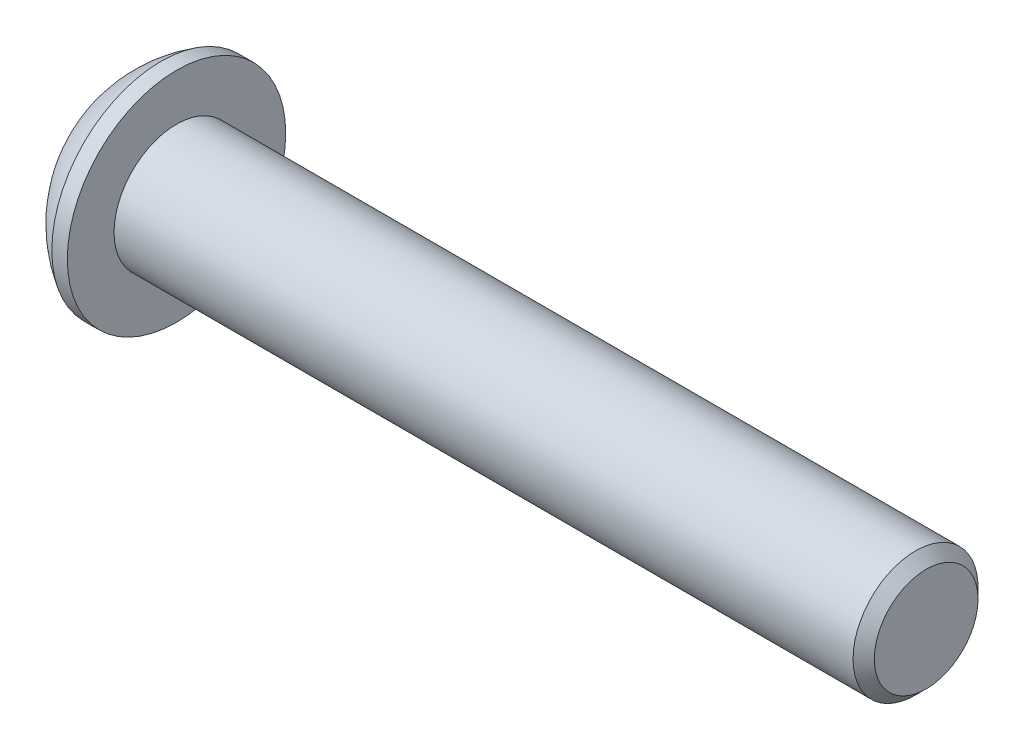
from build123d import *

# Parameters (mm, degrees)
HEX_2_DEPTH = 2.2098


with BuildPart() as part:
    # BodySke → BaseBody (revolve)
    with BuildSketch(Plane.XY, mode=Mode.PRIVATE) as basebody_sk:
        with BuildLine():
            Line((41.4528, 0), (41.4528, 2.63398))
            Line((41.4528, 2.63398), (40.91178, 3.175))
            Line((40.91178, 3.175), (3.3528, 3.175))
            Line((3.3528, 3.175), (3.3528, 5.5499))
            Line((3.3528, 5.5499), (2.5654, 5.5499))
            ThreePointArc((2.5654, 5.5499), (1.073764503, 4.355582759), (0, 2.77495))
            Line((0, 2.77495), (0, 0))
            Line((0, 0), (41.4528, 0))
        make_face()
    revolve(basebody_sk.sketch.rotate(Axis((0, 0, 0), (1, 0, 0)), 90), axis=Axis((0, 0, 0), (1, 0, 0)))

    # Sketch2 → PreBroach (revolve, cut)
    with BuildSketch(Plane.XY, mode=Mode.PRIVATE) as prebroach_sk:
        Polygon((0, 1.9812), (2.2098, 1.9812), (3.353646353, 0), (0, 0), align=None)
    revolve(prebroach_sk.sketch.rotate(Axis((0, 0, 0), (1, 0, 0)), 90), axis=Axis((0, 0, 0), (1, 0, 0)), mode=Mode.SUBTRACT)

    # Sketch3 → Hex 2 (cut)
    with BuildSketch(Plane(origin=(0, 0, 0), x_dir=(0, 0, -1), z_dir=(1, 0, 0))):
        Polygon((-1.9812, -1.143846353), (-1.9812, 1.143846353), (0, 2.287692707), (1.9812, 1.143846353), (1.9812, -1.143846353), (0, -2.287692707), align=None)
    extrude(amount=HEX_2_DEPTH, mode=Mode.SUBTRACT)


solid = part.part
